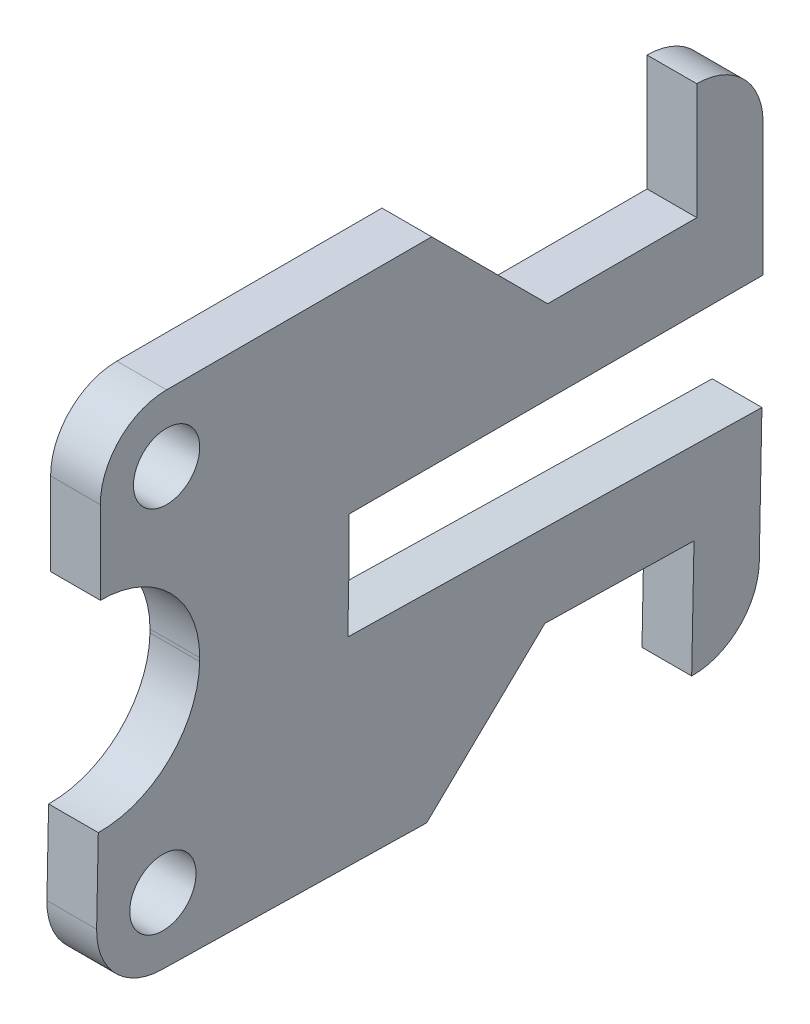
from build123d import *

# Parameters (mm, degrees)
SKETCH1_R           = 2
BOSS_EXTRUDE1_DEPTH = 1.5


with BuildPart() as part:
    # Sketch1 → Boss-Extrude1 (new, symmetric)
    with BuildSketch(Plane(origin=(0, 0, 0), x_dir=(0, 0, -1), z_dir=(1, 0, 0))):
        with BuildLine():
            Line((0, 0), (0, 3))
            Line((0, 3), (25, 3))
            Line((25, 3), (25, 11))
            ThreePointArc((25, 11), (23.828427125, 13.828427125), (21, 15))
            Line((21, 15), (21, 8))
            Line((21, 8), (12, 8))
            Line((12, 8), (5, 15))
            Line((5, 15), (-11, 15))
            ThreePointArc((-11, 15), (-13.828427125, 13.828427125), (-15, 11))
            Line((-15, 11), (-15, 6))
            ThreePointArc((-15, 6), (-10.757359313, 4.242640687), (-9, 0))
            Line((-9, 0), (-9.002044324, -0.203364757))
            ThreePointArc((-9.002044324, -0.203364757), (-10.84433818, -4.409819928), (-15.121449634, -6.081534426))
            Line((-15.121449634, -6.081534426), (-15.221964484, -11.080524))
            ThreePointArc((-15.221964484, -11.080524), (-14.107488152, -13.931931636), (-11.303184704, -15.16012754))
            Line((-11.303184704, -15.16012754), (4.693581934, -15.48177506))
            Line((4.693581934, -15.48177506), (11.832888128, -8.623910446))
            Line((11.832888128, -8.623910446), (20.831069362, -8.804837176))
            Line((20.831069362, -8.804837176), (20.690348572, -15.80342258))
            ThreePointArc((20.690348572, -15.80342258), (23.541756208, -14.688946248), (24.769952111, -11.884642801))
            Line((24.769952111, -11.884642801), (24.930775871, -3.886259482))
            Line((24.930775871, -3.886259482), (-0.064172001, -3.383685231))
            Line((-0.064172001, -3.383685231), (-0.00386309, -0.384291487))
            Line((-0.00386309, -0.384291487), (0, 0))
        make_face()
        with Locations((-11, 11)):
            Circle(SKETCH1_R, mode=Mode.SUBTRACT)
        with Locations(Location((-11.222772824, -11.16093588, 0), (0, 0, 180))):
            Circle(SKETCH1_R, mode=Mode.SUBTRACT)
    extrude(amount=BOSS_EXTRUDE1_DEPTH, both=True)


solid = part.part
